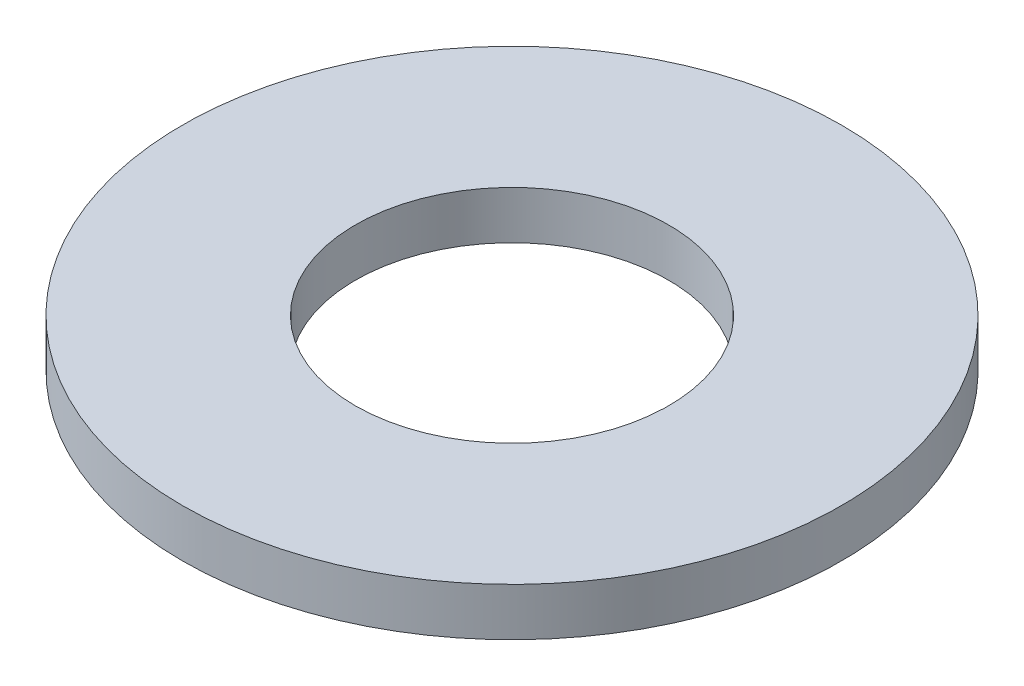
from build123d import *

# Parameters (mm, degrees)
SKETCH1_R           = 5.5
SKETCH1_R_2         = 2.615
BOSS_EXTRUDE1_DEPTH = 0.8


with BuildPart() as part:
    # Sketch1 → Boss-Extrude1 (new body)
    with BuildSketch(Plane(origin=(0, 0, 0), x_dir=(1, 0, 0), z_dir=(0, 1, 0))):
        with Locations(Location((0, 0, 0), (0, 0, 270))):
            Circle(SKETCH1_R)
        with Locations(Location((0, 0, 0), (0, 0, 270))):
            Circle(SKETCH1_R_2, mode=Mode.SUBTRACT)
    extrude(amount=BOSS_EXTRUDE1_DEPTH)


solid = part.part
